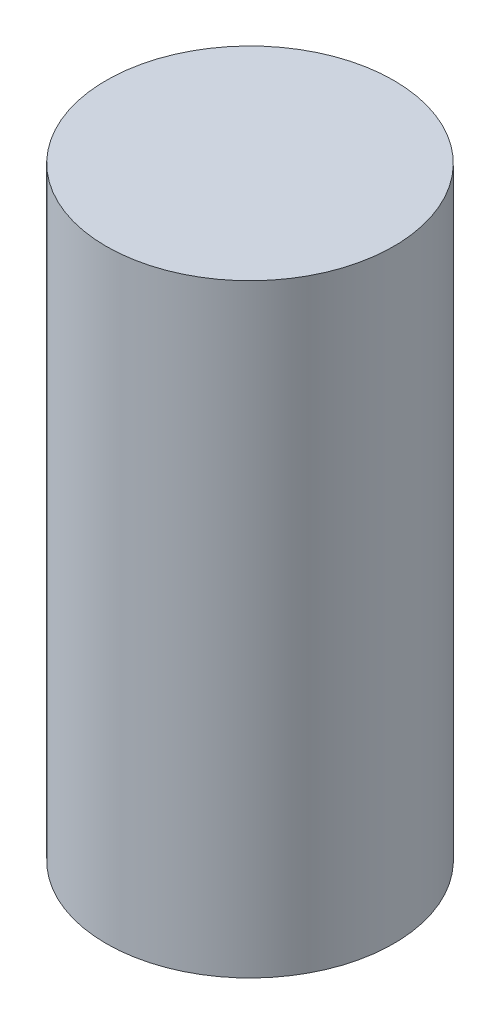
from build123d import *

# Parameters (mm, degrees)
SKETCH1_R           = 2
BOSS_EXTRUDE1_DEPTH = 8.4


with BuildPart() as part:
    # Sketch1 → Boss-Extrude1 (new body)
    with BuildSketch(Plane(origin=(0, 0, 0), x_dir=(1, 0, 0), z_dir=(0, 1, 0))):
        with Locations(Location((0, 0, 0), (0, 0, 270))):
            Circle(SKETCH1_R)
    extrude(amount=BOSS_EXTRUDE1_DEPTH)


solid = part.part
